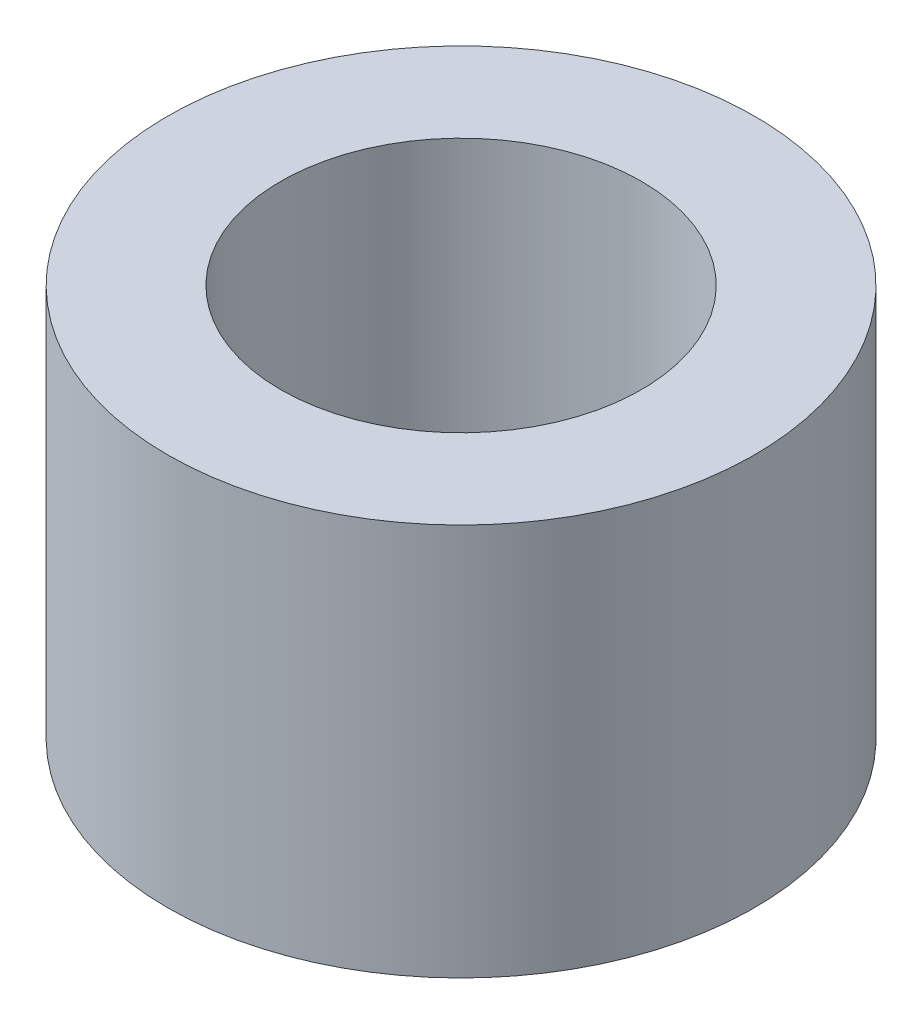
from build123d import *

# Parameters (mm, degrees)
SKETCH1_R           = 2.3749
SKETCH1_R_2         = 1.4605
BOSS_EXTRUDE1_DEPTH = 3.175


with BuildPart() as part:
    # Sketch1 → Boss-Extrude1 (new body)
    with BuildSketch(Plane(origin=(0, 0, 0), x_dir=(1, 0, 0), z_dir=(0, 1, 0))):
        with Locations(Location((0, 0, 0), (0, 0, 270))):
            Circle(SKETCH1_R)
        with Locations(Location((0, 0, 0), (0, 0, 270))):
            Circle(SKETCH1_R_2, mode=Mode.SUBTRACT)
    extrude(amount=BOSS_EXTRUDE1_DEPTH)


solid = part.part
